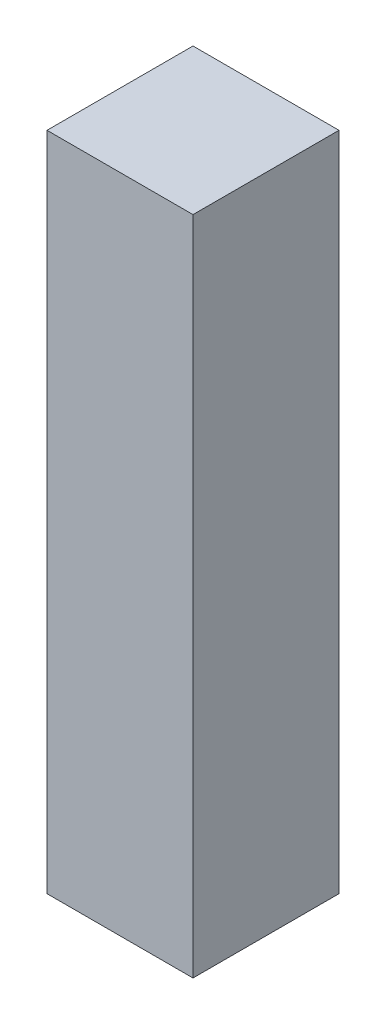
from build123d import *

# Parameters (mm, degrees)
SKETCH1_W           = 2.65
SKETCH1_H           = 2.65
BOSS_EXTRUDE1_DEPTH = 12


with BuildPart() as part:
    # Sketch1 → Boss-Extrude1 (new body)
    with BuildSketch(Plane(origin=(0, 0, 0), x_dir=(1, 0, 0), z_dir=(0, 1, 0))):
        Rectangle(SKETCH1_W, SKETCH1_H)
    extrude(amount=BOSS_EXTRUDE1_DEPTH)


solid = part.part
